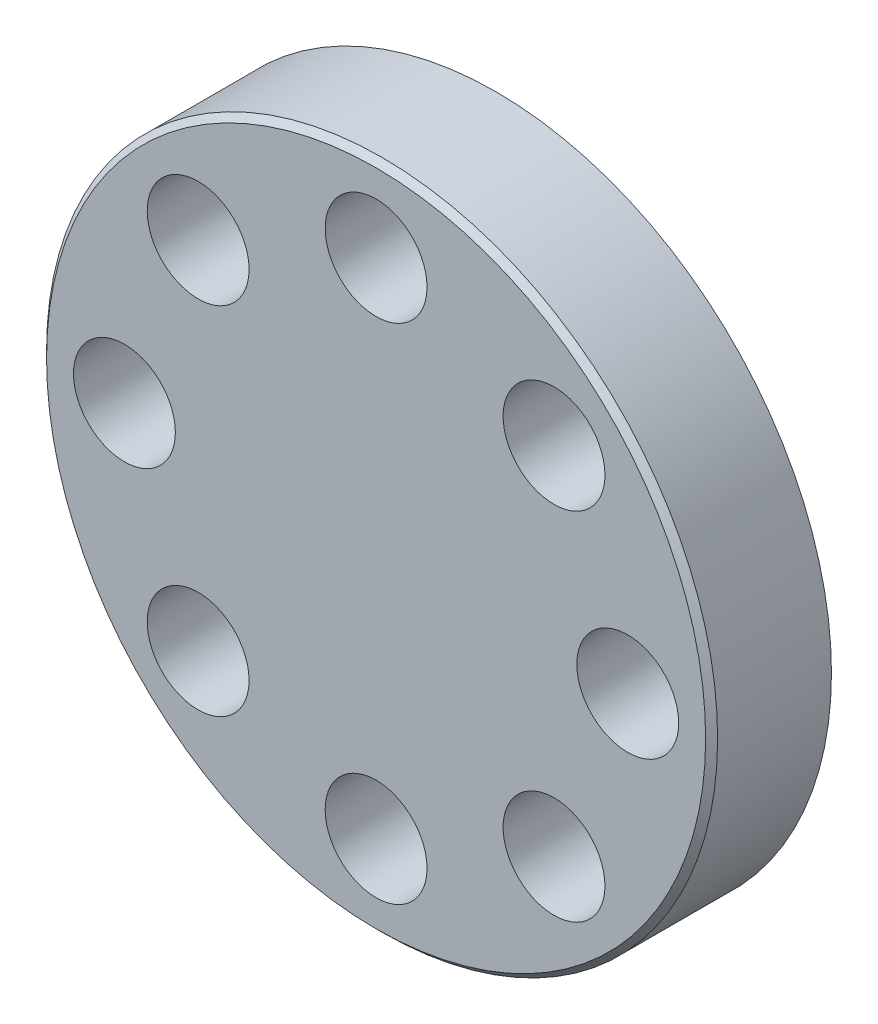
from build123d import *

# Parameters (mm, degrees)
SCHIZZO1_R                   = 10
ESTRUSIONE_ESTRUSIONE1_DEPTH = 10
SCHIZZO2_R                   = 28
ESTRUSIONE_ESTRUSIONE2_DEPTH = 10
SCHIZZO3_R                   = 4.25
TAGLIO_ESTRUSIONE1_DEPTH     = 45.362146026
RIPETIZIONECIRCOLARE1_COUNT  = 8
SMUSSO1_SIZE                 = 0.5
SMUSSO2_SIZE                 = 0.5


with BuildPart() as part:
    # Schizzo1 → Estrusione-Estrusione1 (new body)
    with BuildSketch(Plane.XY):
        Circle(SCHIZZO1_R)
    extrude(amount=ESTRUSIONE_ESTRUSIONE1_DEPTH)

    # Schizzo2 → Estrusione-Estrusione2 (add)
    with BuildSketch(Plane.XY.offset(10)):
        Circle(SCHIZZO2_R)
    extrude(amount=ESTRUSIONE_ESTRUSIONE2_DEPTH)

    # Schizzo3 → Taglio-Estrusione1 (cut, through all)
    with BuildSketch(Plane.XY.offset(20)):
        with Locations((0, 21)):
            Circle(SCHIZZO3_R)
    taglio_estrusione1 = extrude(amount=-TAGLIO_ESTRUSIONE1_DEPTH, mode=Mode.SUBTRACT)

    # RipetizioneCircolare1: Taglio-Estrusione1 ×8 about axis
    ripetizionecircolare1_axis = Axis((0, 0, 0), (0, 0, 1))
    for i in range(1, RIPETIZIONECIRCOLARE1_COUNT):
        add(taglio_estrusione1.rotate(ripetizionecircolare1_axis, i * 360 / RIPETIZIONECIRCOLARE1_COUNT), mode=Mode.SUBTRACT)

    # Smusso1
    smusso1_edges = [part.edges().sort_by_distance(p)[0] for p in [
        (-10, 0, 0),
    ]]
    chamfer(smusso1_edges, length=SMUSSO1_SIZE)

    # Smusso2
    smusso2_edges = [part.edges().sort_by_distance(p)[0] for p in [
        (-28, 0, 20),
    ]]
    chamfer(smusso2_edges, length=SMUSSO2_SIZE)


solid = part.part
